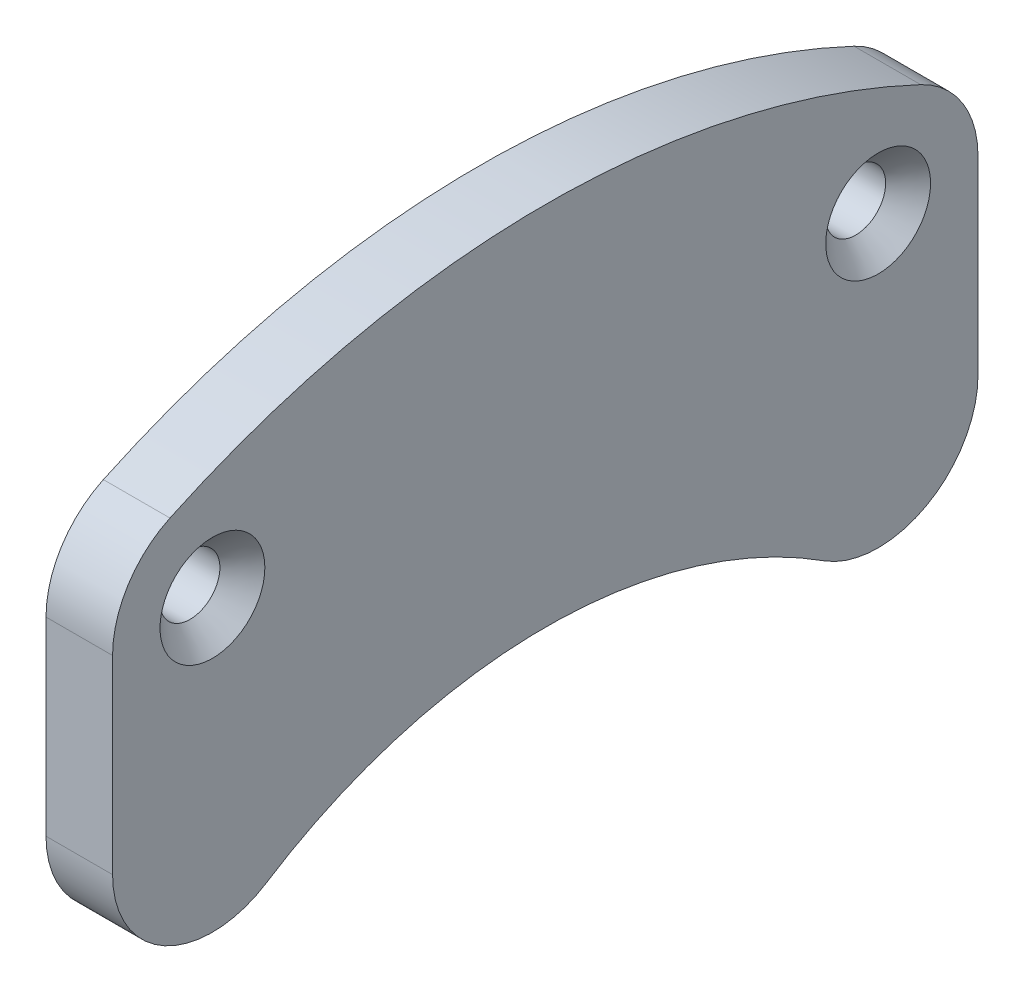
from build123d import *

# Parameters (mm, degrees)
BOSS_EXTRUDE1_START                             = -32.7
SKETCH2_R                                       = 3
BOSS_EXTRUDE1_DEPTH                             = 4
FILLET1_R                                       = 6
CSK_FOR_M3_FLAT_HEAD_MACHINE_SCREW1_D           = 3.6
CSK_FOR_M3_FLAT_HEAD_MACHINE_SCREW1_CSINK_D     = 6.3
CSK_FOR_M3_FLAT_HEAD_MACHINE_SCREW1_CSINK_ANGLE = 90


with BuildPart() as part:
    # Sketch2 → Boss-Extrude1 (new body)
    # profile 1 of 4: a face of its own
    with BuildSketch(Plane(origin=(0, 0, 0), x_dir=(0, 0, -1), z_dir=(1, 0, 0)).offset(BOSS_EXTRUDE1_START)):
        with BuildLine():
            Line((26, -4.467659364), (26, -30.118056984))
            ThreePointArc((26, -30.118056984), (0, -16), (-26, -30.118056984))
            Line((-26, -30.118056984), (-26, -4.467659364))
            ThreePointArc((-26, -4.467659364), (-25.065528054, -1.252006159), (-22.553191489, 0.962001143))
            ThreePointArc((-22.553191489, 0.962001143), (0, 6), (22.553191489, 0.962001143))
            ThreePointArc((22.553191489, 0.962001143), (25.065528054, -1.252006159), (26, -4.467659364))
        make_face()
        with Locations((15, -2.457885097)):
            Circle(SKETCH2_R, mode=Mode.SUBTRACT)
        Circle(SKETCH2_R, mode=Mode.SUBTRACT)
        with Locations((-15, -2.457885097)):
            Circle(SKETCH2_R, mode=Mode.SUBTRACT)
    # profile 2 of 4: a face of its own
    with BuildSketch(Plane(origin=(0, 0, 0), x_dir=(0, 0, -1), z_dir=(1, 0, 0)).offset(BOSS_EXTRUDE1_START)):
        with Locations((-15, -2.457885097)):
            Circle(SKETCH2_R)
    # profile 3 of 4: a face of its own
    with BuildSketch(Plane(origin=(0, 0, 0), x_dir=(0, 0, -1), z_dir=(1, 0, 0)).offset(BOSS_EXTRUDE1_START)):
        Circle(SKETCH2_R)
    # profile 4 of 4: a face of its own
    with BuildSketch(Plane(origin=(0, 0, 0), x_dir=(0, 0, -1), z_dir=(1, 0, 0)).offset(BOSS_EXTRUDE1_START)):
        with Locations((15, -2.457885097)):
            Circle(SKETCH2_R)
    extrude(amount=-BOSS_EXTRUDE1_DEPTH)

    # Fillet1
    fillet1_edges = [part.edges().sort_by_distance(p)[0] for p in [
        (-34.7, -30.118056984, -26),
        (-34.7, -30.118056984, 26),
    ]]
    fillet(fillet1_edges, radius=FILLET1_R)

    # CSK for M3 Flat Head Machine Screw1 (through all)
    with Locations(Plane(origin=(-32.7, 0, 0), x_dir=(0, 0, -1), z_dir=(1, 0, 0))):
        with Locations((-20, -4.467659364), (20, -4.467659364)):
            CounterSinkHole(CSK_FOR_M3_FLAT_HEAD_MACHINE_SCREW1_D / 2, CSK_FOR_M3_FLAT_HEAD_MACHINE_SCREW1_CSINK_D / 2, counter_sink_angle=CSK_FOR_M3_FLAT_HEAD_MACHINE_SCREW1_CSINK_ANGLE)


solid = part.part
